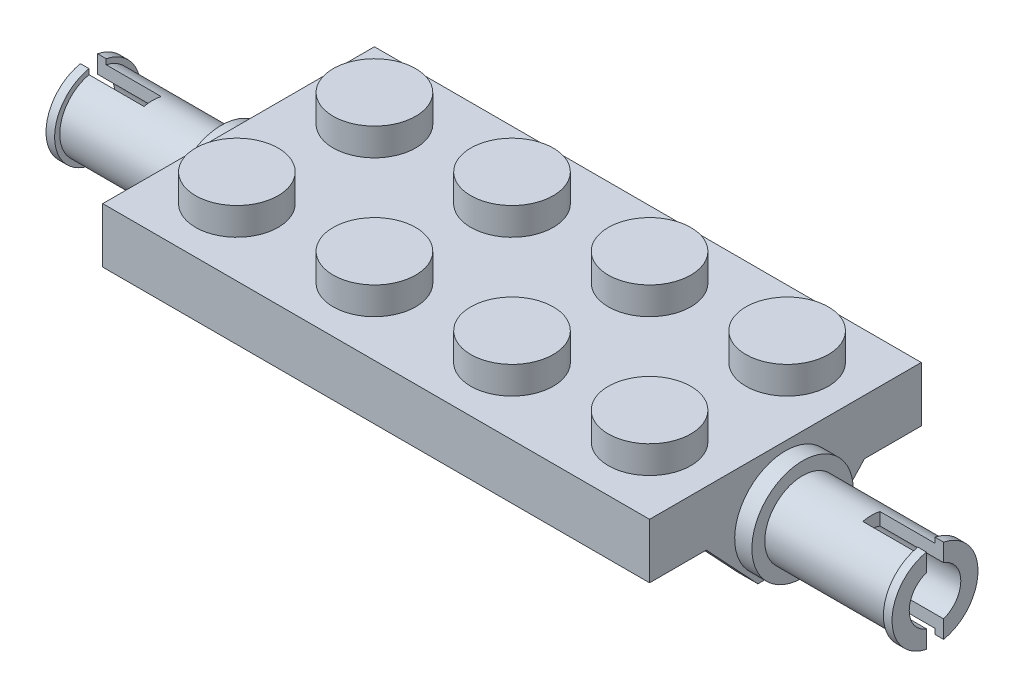
from build123d import *

# Parameters (mm, degrees)
SKETCH1_W            = 31.8
SKETCH1_H            = 3.2
BOSS_EXTRUDE1_DEPTH  = 15.8
SKETCH2_R            = 2.4
BOSS_EXTRUDE2_DEPTH  = 1.6
LPATTERN1_COUNT      = 2
LPATTERN1_PITCH      = 8
LPATTERN1_COUNT_DIR2 = 6
LPATTERN1_PITCH_DIR2 = 8
SHELL1_T             = -1.2
SKETCH3_R            = 3.25
SKETCH3_R_2          = 2.4
BOSS_EXTRUDE3_DEPTH  = 1.8
SKETCH4_W            = 0.8
SKETCH4_H            = 13.4
BOSS_EXTRUDE4_DEPTH  = 1.8
BOSS_EXTRUDE5_DEPTH  = 1.2
SKETCH7_R            = 2.95
BOSS_EXTRUDE6_DEPTH  = 1
SKETCH8_R            = 2.2
SKETCH8_R_2          = 1.5
BOSS_EXTRUDE7_DEPTH  = 7.7
BOSS_EXTRUDE8_START  = -0.5
SKETCH9_R            = 2.5
SKETCH9_R_2          = 2.2
BOSS_EXTRUDE8_DEPTH  = 0.5
CUT_EXTRUDE1_START   = -3.7
CUT_EXTRUDE1_DEPTH   = 3.7


with BuildPart() as part:
    # Sketch1 → Boss-Extrude1 (new body)
    with BuildSketch(Plane.XY):
        with Locations((15.9, 1.6)):
            Rectangle(SKETCH1_W, SKETCH1_H)
    extrude(amount=-BOSS_EXTRUDE1_DEPTH)

    # Sketch2 → Boss-Extrude2 (add)
    with BuildSketch(Plane(origin=(0, 3.2, 0), x_dir=(1, 0, 0), z_dir=(0, 1, 0))):
        with Locations(Location((3.9, 3.9, 0), (0, 0, 270))):
            Circle(SKETCH2_R)
    boss_extrude2 = extrude(amount=BOSS_EXTRUDE2_DEPTH)

    # LPattern1: Boss-Extrude2 2 × 6, 4 skipped
    with Locations(*[(j * LPATTERN1_PITCH_DIR2, 0, -i * LPATTERN1_PITCH) for i in range(LPATTERN1_COUNT) for j in range(LPATTERN1_COUNT_DIR2) if (i, j) not in ((0, 0), (0, 4), (0, 5), (1, 4), (1, 5))]):
        add(boss_extrude2)

    # Shell1
    shell1_openings = [part.faces().sort_by_distance(p)[0] for p in [
        (15.9, 0, -7.9),
    ]]
    offset(amount=SHELL1_T, openings=shell1_openings, kind=Kind.INTERSECTION)

    # Sketch3 → Boss-Extrude3 (add)
    with BuildSketch(Plane.XZ.offset(-2)):
        with Locations(Location((15.9, -7.9, 0), (0, 0, 90))):
            Circle(SKETCH3_R)
        with Locations(Location((15.9, -7.9, 0), (0, 0, 270))):
            Circle(SKETCH3_R_2, mode=Mode.SUBTRACT)
    extrude(amount=BOSS_EXTRUDE3_DEPTH)

    # Sketch4 → Boss-Extrude4 (add)
    with BuildSketch(Plane.XZ.offset(-2)):
        with Locations((9.1, -7.9)):
            Rectangle(SKETCH4_W, SKETCH4_H)
        with Locations((22.7, -7.9)):
            Rectangle(SKETCH4_W, SKETCH4_H)
    extrude(amount=BOSS_EXTRUDE4_DEPTH)

    # Sketch5 → Boss-Extrude5 (add)
    with BuildSketch(Plane(origin=(31.8, 0, 0), x_dir=(0, 0, -1), z_dir=(1, 0, 0))):
        Polygon((6.3, -3.2), (9.5, -3.2), (12.5, 0), (3.3, 0), align=None)
    boss_extrude5 = extrude(amount=-BOSS_EXTRUDE5_DEPTH)

    # Mirror1: Boss-Extrude5 across plane
    add(boss_extrude5.mirror(Plane.ZY.offset(-15.9)))

    # Sketch7 → Boss-Extrude6 (add)
    with BuildSketch(Plane(origin=(31.8, 0, 0), x_dir=(0, 0, -1), z_dir=(1, 0, 0))):
        with Locations(Location((7.9, -0.25, 0), (0, 0, 270))):
            Circle(SKETCH7_R)
    boss_extrude6 = extrude(amount=BOSS_EXTRUDE6_DEPTH)

    # Sketch8 → Boss-Extrude7 (add)
    with BuildSketch(Plane(origin=(32.8, 0, 0), x_dir=(0, 0, -1), z_dir=(1, 0, 0))):
        with Locations(Location((7.9, -0.25, 0), (0, 0, 180))):
            Circle(SKETCH8_R)
        with Locations(Location((7.9, -0.25, 0), (0, 0, 180))):
            Circle(SKETCH8_R_2, mode=Mode.SUBTRACT)
    boss_extrude7 = extrude(amount=BOSS_EXTRUDE7_DEPTH)

    # Sketch9 → Boss-Extrude8 (add)
    with BuildSketch(Plane(origin=(40.5, 0, 0), x_dir=(0, 0, -1), z_dir=(1, 0, 0)).offset(BOSS_EXTRUDE8_START)):
        with Locations((7.9, -0.25)):
            Circle(SKETCH9_R)
        with Locations(Location((7.9, -0.25, 0), (0, 0, 180))):
            Circle(SKETCH9_R_2, mode=Mode.SUBTRACT)
    boss_extrude8 = extrude(amount=BOSS_EXTRUDE8_DEPTH)

    # Sketch10 → Cut-Extrude1 (cut)
    with BuildSketch(Plane(origin=(40.5, 0, 0), x_dir=(0, 0, -1), z_dir=(1, 0, 0)).offset(CUT_EXTRUDE1_START)):
        with BuildLine():
            Line((7.9, -1.75), (7.9, -2.75))
            ThreePointArc((7.9, -2.75), (8.151272405, -2.737340383), (8.4, -2.699489743))
            Line((8.4, -2.699489743), (8.4, -1.664213562))
            ThreePointArc((8.4, -1.664213562), (8.153652968, -1.728397839), (7.9, -1.75))
        make_face()
        with BuildLine():
            Line((7.9, 2.25), (7.9, 1.25))
            ThreePointArc((7.9, 1.25), (8.153652968, 1.228397839), (8.4, 1.164213562))
            Line((8.4, 1.164213562), (8.4, 2.199489743))
            ThreePointArc((8.4, 2.199489743), (8.151272405, 2.237340383), (7.9, 2.25))
        make_face()
        with BuildLine():
            ThreePointArc((7.4, -2.699489743), (7.648727595, -2.737340383), (7.9, -2.75))
            Line((7.9, -2.75), (7.9, -1.75))
            ThreePointArc((7.9, -1.75), (7.646347032, -1.728397839), (7.4, -1.664213562))
            Line((7.4, -1.664213562), (7.4, -2.699489743))
        make_face()
        with BuildLine():
            ThreePointArc((7.4, 1.164213562), (7.646347032, 1.228397839), (7.9, 1.25))
            Line((7.9, 1.25), (7.9, 2.25))
            ThreePointArc((7.9, 2.25), (7.648727595, 2.237340383), (7.4, 2.199489743))
            Line((7.4, 2.199489743), (7.4, 1.164213562))
        make_face()
    cut_extrude1 = extrude(amount=CUT_EXTRUDE1_DEPTH, mode=Mode.SUBTRACT)

    # Mirror2: Boss-Extrude6, Boss-Extrude7, Boss-Extrude8, Cut-Extrude1 across plane
    add(boss_extrude6.mirror(Plane.ZY.offset(-15.9)))
    add(boss_extrude7.mirror(Plane.ZY.offset(-15.9)))
    add(boss_extrude8.mirror(Plane.ZY.offset(-15.9)))
    add(cut_extrude1.mirror(Plane.ZY.offset(-15.9)), mode=Mode.SUBTRACT)


solid = part.part
